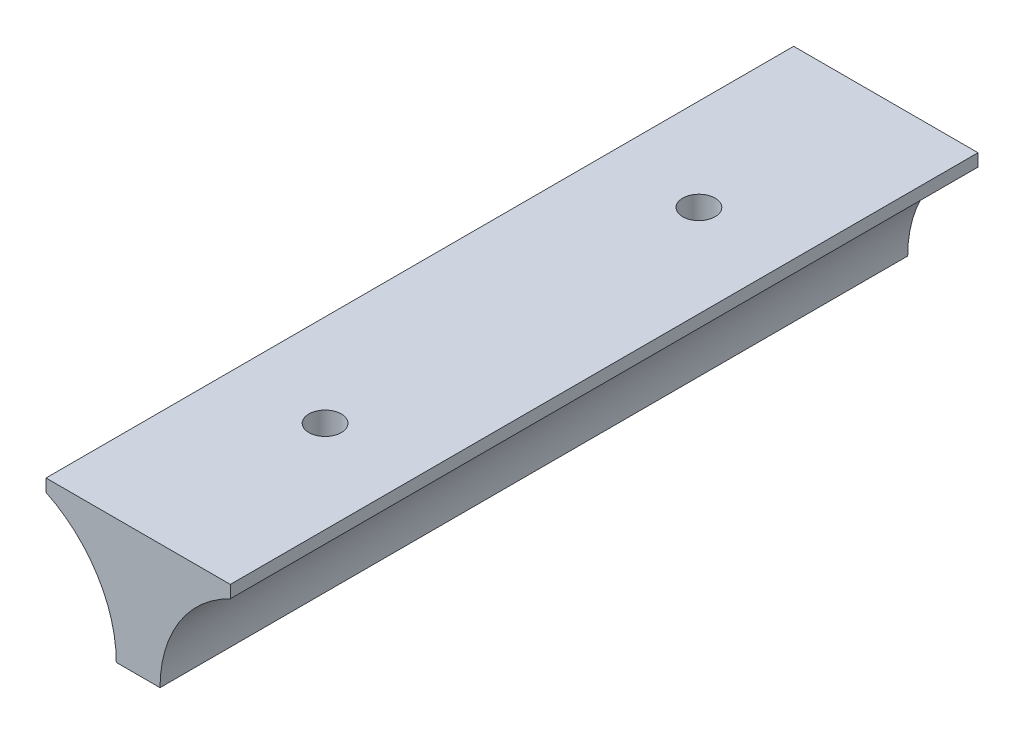
from build123d import *

# Parameters (mm, degrees)
BOSS_EXTRUDE1_DEPTH        = 60
F_2_6_2_6_DIAMETER_HOLE1_D = 2.6


with BuildPart() as part:
    # Sketch1 → Boss-Extrude1 (new body)
    with BuildSketch(Plane.XY):
        with BuildLine():
            Line((-1.7545, 0), (1.7545, 0))
            ThreePointArc((1.7545, 0), (3.281336794, 5.310885546), (7.395601056, 9))
            Line((7.395601056, 9), (7.395601056, 10))
            Line((7.395601056, 10), (-7.395601056, 10))
            Line((-7.395601056, 10), (-7.395601056, 9))
            ThreePointArc((-7.395601056, 9), (-3.281336794, 5.310885546), (-1.7545, 0))
        make_face()
    extrude(amount=BOSS_EXTRUDE1_DEPTH)

    # Ø2.6 (2.6) Diameter Hole1 (through all)
    with Locations(Plane(origin=(0, 10, 45), x_dir=(0, 0, 1), z_dir=(0, 1, 0))):
        with Locations((0, 0), (-30, 0)):
            Hole(F_2_6_2_6_DIAMETER_HOLE1_D / 2)


solid = part.part
